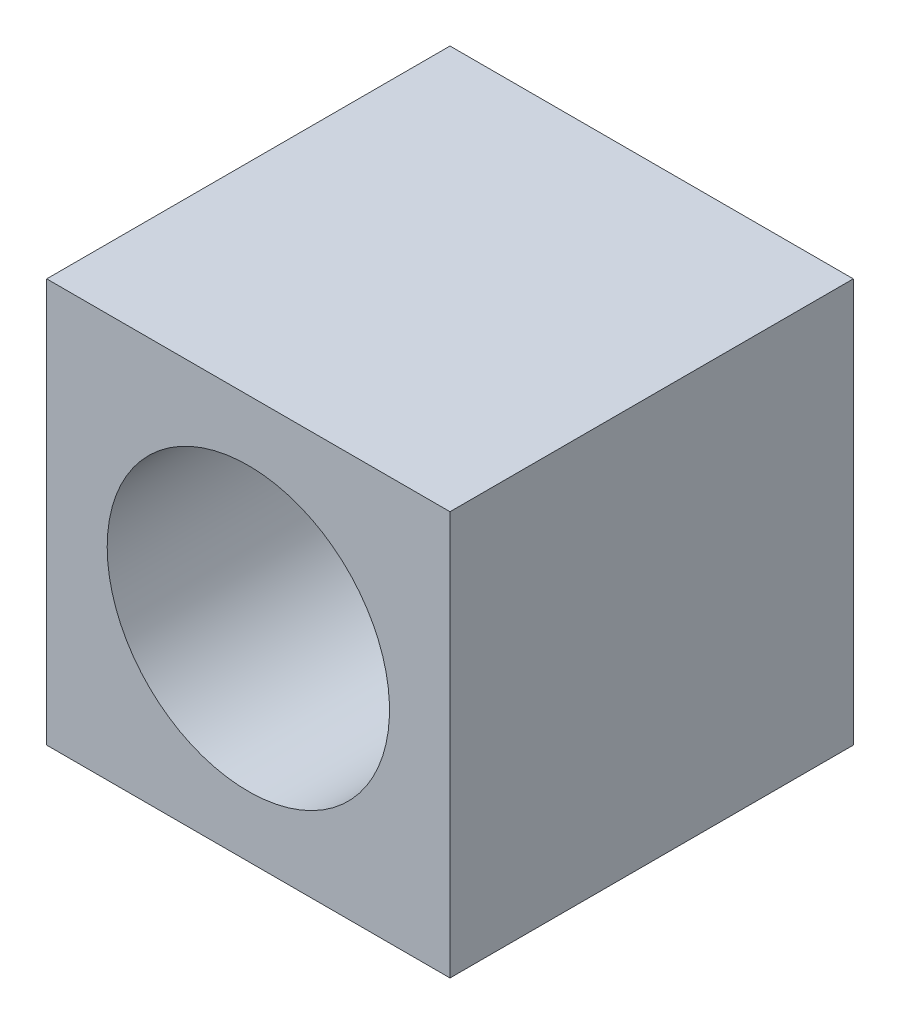
from build123d import *

# Parameters (mm, degrees)
SKETCH1_W           = 38.1
SKETCH1_H           = 38.149988338
SKETCH1_R           = 13.335
BOSS_EXTRUDE1_DEPTH = 38.1


with BuildPart() as part:
    # Sketch1 → Boss-Extrude1 (new body)
    with BuildSketch(Plane.XY):
        Rectangle(SKETCH1_W, SKETCH1_H)
        Circle(SKETCH1_R, mode=Mode.SUBTRACT)
    extrude(amount=BOSS_EXTRUDE1_DEPTH)


solid = part.part
